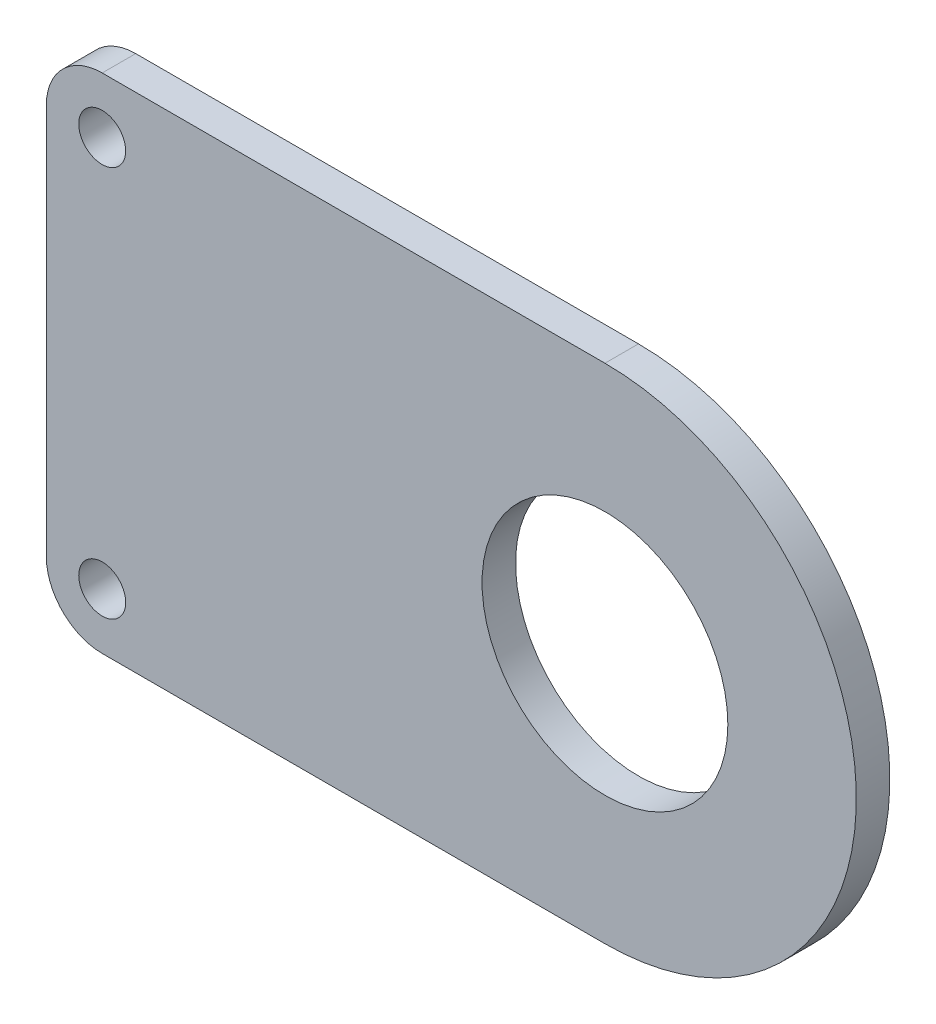
from build123d import *

# Parameters (mm, degrees)
SKETCH_1_R      = 11
SKETCH_1_R_2    = 2.1
EXTRUDE_1_DEPTH = 3
FILLET_1_R      = 5


with BuildPart() as part:
    # ｽｹｯﾁ1 → ﾎﾞｽ - 押し出し1 (new body)
    with BuildSketch(Plane.XY):
        with BuildLine():
            Line((-40, 22.5), (0, 22.5))
            ThreePointArc((0, 22.5), (22.5, 0), (0, -22.5))
            Line((0, -22.5), (-40, -22.5))
            Line((-40, -22.5), (-50, -22.5))
            Line((-50, -22.5), (-50, 22.5))
            Line((-50, 22.5), (-40, 22.5))
        make_face()
        Circle(SKETCH_1_R, mode=Mode.SUBTRACT)
        with Locations((-45, 17.5)):
            Circle(SKETCH_1_R_2, mode=Mode.SUBTRACT)
        with Locations(Location((-45, -17.5, 0), (0, 0, 180))):
            Circle(SKETCH_1_R_2, mode=Mode.SUBTRACT)
    extrude(amount=EXTRUDE_1_DEPTH)

    # ﾌｨﾚｯﾄ1
    fillet_1_edges = [part.edges().sort_by_distance(p)[0] for p in [
        (-50, -22.5, 1.5),
        (-50, 22.5, 1.5),
    ]]
    fillet(fillet_1_edges, radius=FILLET_1_R)


solid = part.part
